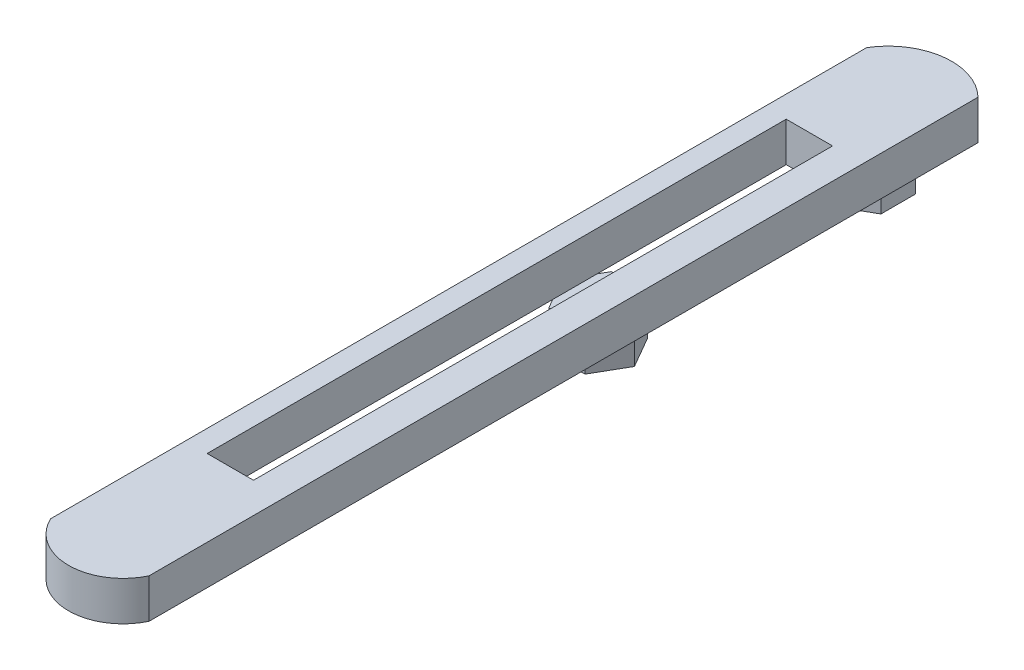
from build123d import *

# Parameters (mm, degrees)
BOSS_EXTRUDE1_DEPTH = 2
SKETCH3_W           = 2.352038348
SKETCH3_H           = 29.381645189
CUT_EXTRUDE1_DEPTH  = 10
BOSS_EXTRUDE6_DEPTH = 2
BOSS_EXTRUDE9_DEPTH = 2


with BuildPart() as part:
    # Sketch1 → Boss-Extrude1 (new body)
    with BuildSketch(Plane(origin=(0, 0, 0), x_dir=(1, 0, 0), z_dir=(0, 1, 0))):
        with BuildLine():
            Line((2.5, -24.892218109), (2.5, 17.168276032))
            ThreePointArc((2.5, 17.168276032), (-0.157753681, 18.055867427), (-2.504670814, 16.525033312))
            Line((-2.504670814, 16.525033312), (-2.504670814, -24.882267467))
            ThreePointArc((-2.504670814, -24.882267467), (-0.005496175, -26.4769499), (2.5, -24.892218109))
        make_face()
    extrude(amount=BOSS_EXTRUDE1_DEPTH)

    # Sketch3 → Cut-Extrude1 (cut)
    with BuildSketch(Plane(origin=(0, 0, 0), x_dir=(-1, 0, 0), z_dir=(0, -1, 0))):
        with Locations((0.225062248, -3.353285415)):
            Rectangle(SKETCH3_W, SKETCH3_H)
    extrude(amount=-CUT_EXTRUDE1_DEPTH, mode=Mode.SUBTRACT)

    # Sketch8 → Boss-Extrude6 (add)
    with BuildSketch(Plane(origin=(0, 0, 0), x_dir=(-1, 0, 0), z_dir=(0, -1, 0))):
        Polygon((0.354887885, 16.216439576), (-1.169599114, 15.336276597), (-1.169599114, 13.575950638), (0.354887885, 12.695787659), (1.879374884, 13.575950638), (1.879374884, 15.336276597), align=None)
    extrude(amount=BOSS_EXTRUDE6_DEPTH)

    # Sketch9 → Boss-Extrude9 (add)
    with BuildSketch(Plane(origin=(0, 0, 0), x_dir=(-1, 0, 0), z_dir=(0, -1, 0))):
        Polygon((-1.616477648, 0.618051223), (-0.699382455, -0.970404247), (1.13480793, -0.970404247), (2.051903123, 0.618051223), (1.13480793, 2.206506692), (-0.699382455, 2.206506692), align=None)
    extrude(amount=BOSS_EXTRUDE9_DEPTH)


solid = part.part
